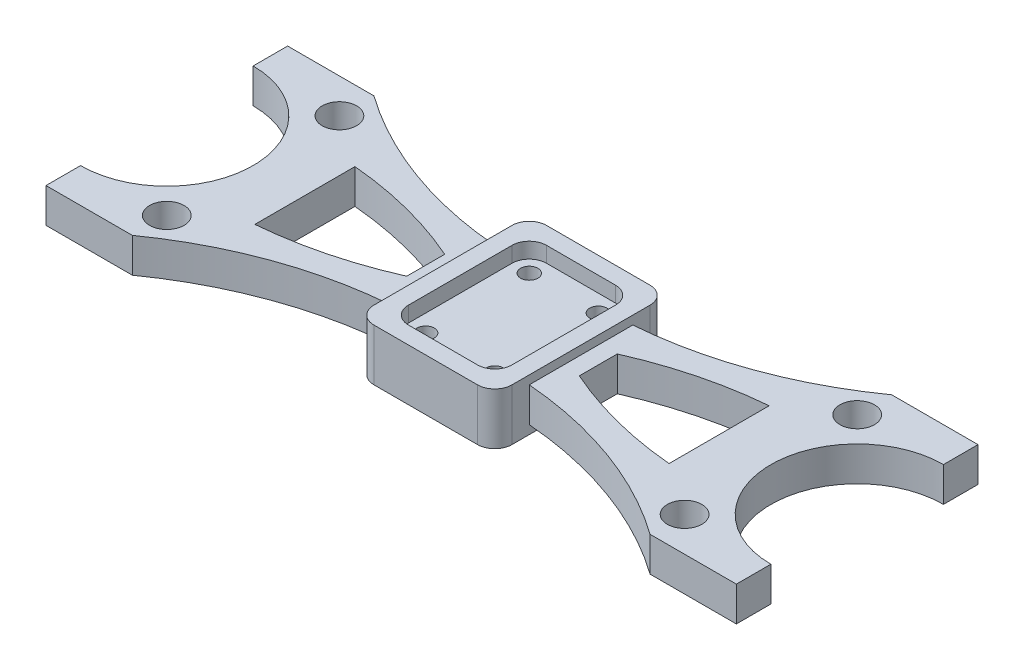
from build123d import *

# Parameters (mm, degrees)
SKETCH1_R             = 5
BOSS_EXTRUDE1_DEPTH   = 5
BOSS_EXTRUDE1_2_DEPTH = 5
SKETCH1_3_R           = 2.5
BOSS_EXTRUDE2_DEPTH   = 3
BOSS_EXTRUDE3_DEPTH   = 7.5


with BuildPart() as part:
    # Sketch1 → Boss-Extrude1 (new, symmetric)
    with BuildSketch(Plane(origin=(0, 0, 0), x_dir=(1, 0, 0), z_dir=(0, 1, 0))):
        with BuildLine():
            ThreePointArc((-75, -35), (-48.85448144, -21.27517604), (-20, -15))
            Line((-20, -15), (-20, 15))
            ThreePointArc((-20, 15), (-48.85448144, 21.27517604), (-75, 35))
            Line((-75, 35), (-100, 35))
            Line((-100, 35), (-100, 25))
            ThreePointArc((-100, 25), (-75, 0), (-100, -25))
            Line((-100, -25), (-100, -35))
            Line((-100, -35), (-75, -35))
        make_face()
        with Locations(Location((-75, -25, 0), (0, 0, 270))):
            Circle(SKETCH1_R, mode=Mode.SUBTRACT)
        with BuildLine():
            Line((-60, -14.5), (-60, 14.5))
            ThreePointArc((-60, 14.5), (-42.12787297, 11.447160671), (-25, 5.5))
            Line((-25, 5.5), (-25, -5.5))
            ThreePointArc((-25, -5.5), (-42.12787297, -11.447160671), (-60, -14.5))
        make_face(mode=Mode.SUBTRACT)
        with Locations(Location((-75, 25, 0), (0, 0, 270))):
            Circle(SKETCH1_R, mode=Mode.SUBTRACT)
    extrude(amount=BOSS_EXTRUDE1_DEPTH, both=True)



with BuildPart() as body_2:
    # Sketch1 → Boss-Extrude1 2 (new, symmetric)
    with BuildSketch(Plane(origin=(0, 0, 0), x_dir=(1, 0, 0), z_dir=(0, 1, 0))):
        with BuildLine():
            Line((20, 15), (20, -15))
            ThreePointArc((20, -15), (48.85448144, -21.27517604), (75, -35))
            Line((75, -35), (100, -35))
            Line((100, -35), (100, -25))
            ThreePointArc((100, -25), (75, 0), (100, 25))
            Line((100, 25), (100, 35))
            Line((100, 35), (75, 35))
            ThreePointArc((75, 35), (48.85448144, 21.27517604), (20, 15))
        make_face()
        with Locations(Location((75, -25, 0), (0, 0, 270))):
            Circle(SKETCH1_R, mode=Mode.SUBTRACT)
        with BuildLine():
            ThreePointArc((60, -14.5), (42.12787297, -11.447160671), (25, -5.5))
            Line((25, -5.5), (25, 5.5))
            ThreePointArc((25, 5.5), (42.12787297, 11.447160671), (60, 14.5))
            Line((60, 14.5), (60, -14.5))
        make_face(mode=Mode.SUBTRACT)
        with Locations(Location((75, 25, 0), (0, 0, 270))):
            Circle(SKETCH1_R, mode=Mode.SUBTRACT)
    extrude(amount=BOSS_EXTRUDE1_2_DEPTH, both=True)


with BuildPart() as body_3:
    # Sketch1<3> → Boss-Extrude2 (new, symmetric)
    with BuildSketch(Plane(origin=(0, 0, 0), x_dir=(1, 0, 0), z_dir=(0, 1, 0))):
        with BuildLine():
            Line((15, 15), (15, -15))
            ThreePointArc((15, -15), (13.535533906, -18.535533906), (10, -20))
            Line((10, -20), (-10, -20))
            ThreePointArc((-10, -20), (-13.535533906, -18.535533906), (-15, -15))
            Line((-15, -15), (-15, 15))
            ThreePointArc((-15, 15), (-13.535533906, 18.535533906), (-10, 20))
            Line((-10, 20), (10, 20))
            ThreePointArc((10, 20), (13.535533906, 18.535533906), (15, 15))
        make_face()
        with Locations(Location((10, 15, 0), (0, 0, 270))):
            Circle(SKETCH1_3_R, mode=Mode.SUBTRACT)
        with Locations(Location((-10, 15, 0), (0, 0, 270))):
            Circle(SKETCH1_3_R, mode=Mode.SUBTRACT)
        with Locations(Location((-10, -15, 0), (0, 0, 270))):
            Circle(SKETCH1_3_R, mode=Mode.SUBTRACT)
        with Locations(Location((10, -15, 0), (0, 0, 270))):
            Circle(SKETCH1_3_R, mode=Mode.SUBTRACT)
    extrude(amount=BOSS_EXTRUDE2_DEPTH, both=True)


with BuildPart() as part_1:
    add(part.part)

    add(body_2.part)  # Boss-Extrude3 merges body 2

    add(body_3.part)  # Boss-Extrude3 merges body 3
    # Sketch1<4> → Boss-Extrude3 (add, symmetric)
    with BuildSketch(Plane(origin=(0, 0, 0), x_dir=(1, 0, 0), z_dir=(0, 1, 0))):
        with BuildLine():
            ThreePointArc((-15, -25), (-18.535533906, -23.535533906), (-20, -20))
            Line((-20, -20), (-20, 20))
            ThreePointArc((-20, 20), (-18.535533906, 23.535533906), (-15, 25))
            Line((-15, 25), (15, 25))
            ThreePointArc((15, 25), (18.535533906, 23.535533906), (20, 20))
            Line((20, 20), (20, -20))
            ThreePointArc((20, -20), (18.535533906, -23.535533906), (15, -25))
            Line((15, -25), (-15, -25))
        make_face()
        with BuildLine():
            ThreePointArc((15, 15), (13.535533906, 18.535533906), (10, 20))
            Line((10, 20), (-10, 20))
            ThreePointArc((-10, 20), (-13.535533906, 18.535533906), (-15, 15))
            Line((-15, 15), (-15, -15))
            ThreePointArc((-15, -15), (-13.535533906, -18.535533906), (-10, -20))
            Line((-10, -20), (10, -20))
            ThreePointArc((10, -20), (13.535533906, -18.535533906), (15, -15))
            Line((15, -15), (15, 15))
        make_face(mode=Mode.SUBTRACT)
    extrude(amount=BOSS_EXTRUDE3_DEPTH, both=True)


solid = part_1.part
